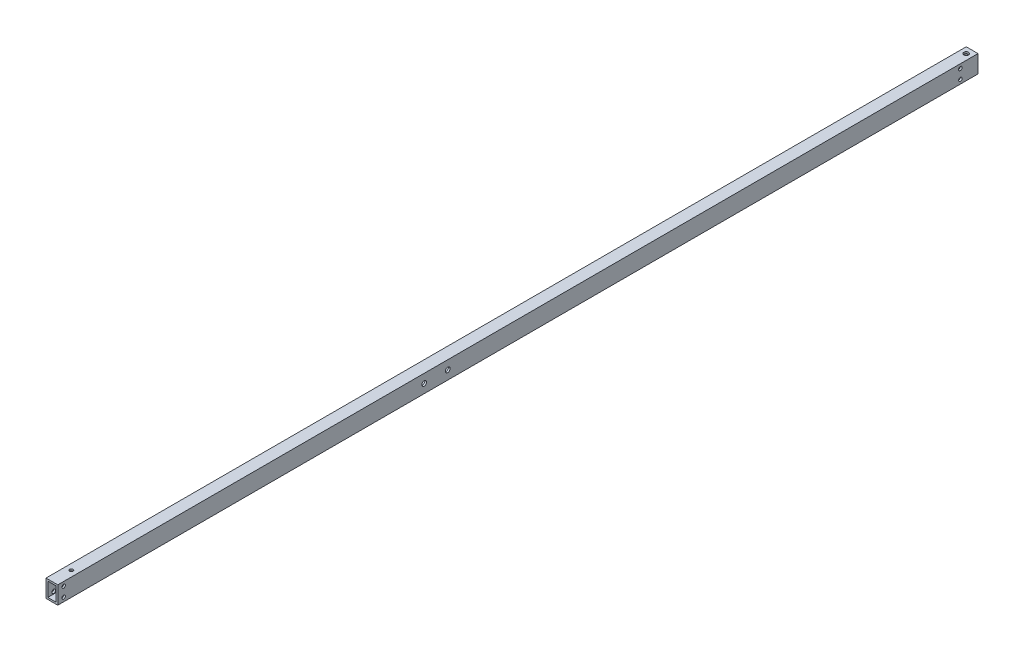
from build123d import *

# Parameters (mm, degrees)
SKETCH_1_W          = 10
SKETCH_1_H          = 15
SKETCH_1_W_2        = 7
SKETCH_1_H_2        = 12
EXTRUDE_1_DEPTH     = 781
SKETCH_2_R          = 2
SKETCH_2_R_2        = 1.5
CUT_EXTRUDE_1_DEPTH = 782.100025605
SKETCH_3_R          = 2
SKETCH_3_R_2        = 1.5
CUT_EXTRUDE_2_DEPTH = 782.16003482


with BuildPart() as part:
    # ｽｹｯﾁ1 → 押し出し-薄板1 (new body)
    with BuildSketch(Plane.XY):
        Rectangle(SKETCH_1_W, SKETCH_1_H)
        Rectangle(SKETCH_1_W_2, SKETCH_1_H_2, mode=Mode.SUBTRACT)
    extrude(amount=EXTRUDE_1_DEPTH)

    # ｽｹｯﾁ2 → ｶｯﾄ - 押し出し1 (cut, through all)
    with BuildSketch(Plane(origin=(5, 0, 0), x_dir=(0, 0, -1), z_dir=(1, 0, 0))):
        with Locations((-470, 0)):
            Circle(SKETCH_2_R)
        with Locations((-450, 0)):
            Circle(SKETCH_2_R)
        with Locations((-15, 4)):
            Circle(SKETCH_2_R_2)
        with Locations((-15, -4)):
            Circle(SKETCH_2_R_2)
        with Locations((-776, 4)):
            Circle(SKETCH_2_R_2)
        with Locations((-776, -4)):
            Circle(SKETCH_2_R_2)
    extrude(amount=-CUT_EXTRUDE_1_DEPTH, mode=Mode.SUBTRACT)

    # ｽｹｯﾁ3 → ｶｯﾄ - 押し出し2 (cut, through all)
    with BuildSketch(Plane(origin=(0, 7.5, 0), x_dir=(1, 0, 0), z_dir=(0, 1, 0))):
        with Locations(Location((0, -5, 0), (0, 0, 270))):
            Circle(SKETCH_3_R)
        with Locations(Location((0, -764.5, 0), (0, 0, 270))):
            Circle(SKETCH_3_R_2)
    extrude(amount=-CUT_EXTRUDE_2_DEPTH, mode=Mode.SUBTRACT)


solid = part.part
